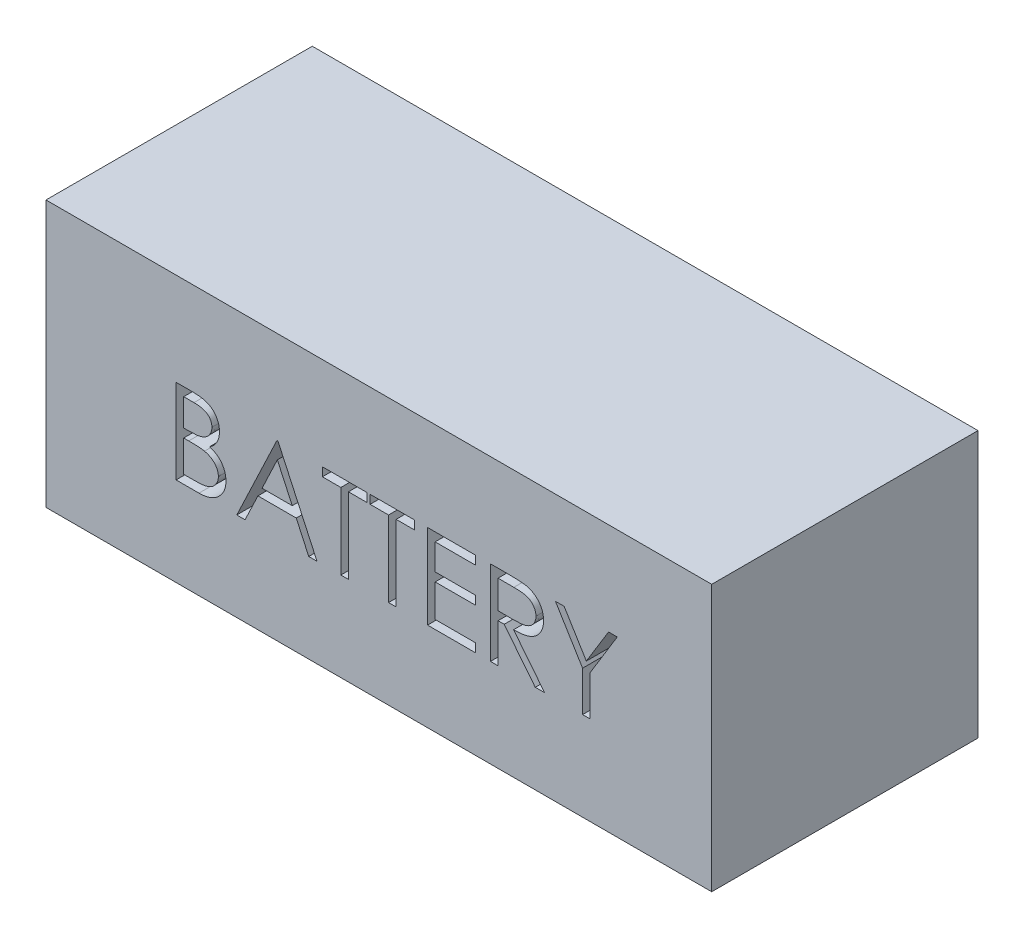
from build123d import *

# Parameters (mm, degrees)
SKETCH1_W           = 60
SKETCH1_H           = 60
BOSS_EXTRUDE1_DEPTH = 75
CUT_EXTRUDE1_DEPTH  = 10


with BuildPart() as part:
    # Sketch1 → Boss-Extrude1 (new, symmetric)
    with BuildSketch(Plane(origin=(0, 0, 0), x_dir=(0, 0, -1), z_dir=(1, 0, 0))):
        Rectangle(SKETCH1_W, SKETCH1_H)
    extrude(amount=BOSS_EXTRUDE1_DEPTH, both=True)

    # Sketch2 → Cut-Extrude1 (cut)
    # profile 1 of 7: a face of its own
    with BuildSketch(Plane.XY.offset(30)):
        with BuildLine():
            Line((-45.686803881, 9.075416007), (-41.969916862, 9.075416007))
            add(Edge.make_bspline(
                [(-41.969916862, 9.075416007), (-41.78797043, 9.074459423), (-41.435312964, 9.072605324), (-40.922490002, 9.043849996), (-40.442164333, 9.00464145), (-39.994196658, 8.942429089), (-39.578793977, 8.867362416), (-39.194704409, 8.776456817), (-38.843149329, 8.66745482), (-38.42343572, 8.494120061), (-37.944896123, 8.236546816), (-37.426744872, 7.855935625), (-36.983673226, 7.390394648), (-36.601659128, 6.865253337), (-36.297941605, 6.287571494), (-36.078217287, 5.671117909), (-35.939109423, 5.023843857), (-35.924803231, 4.579471703), (-35.917573112, 4.354893171)],
                knots=[0, 0, 0, 0, 1.001505555, 1.941167018, 2.826882275, 3.653841531, 4.429895133, 5.150066043, 5.825578002, 6.45369114, 7.647487171, 8.808567382, 9.977351308, 11.170798116, 12.373658725, 13.556498008, 14.765093433, 16, 16, 16, 16], degree=3))
            add(Edge.make_bspline(
                [(-35.917573112, 4.354893171), (-35.923523343, 4.144512832), (-35.93521611, 3.731095626), (-36.047027414, 3.12642626), (-36.222073338, 2.550837483), (-36.465397623, 2.006429929), (-36.781638488, 1.50550412), (-37.15642448, 1.044019143), (-37.608599648, 0.641514104), (-37.947380711, 0.416490592), (-38.119466141, 0.302188844)],
                knots=[0, 0, 0, 0, 1.044552857, 2.05264487, 3.044412934, 4.028983338, 5.005914585, 5.980388656, 6.974128949, 8, 8, 8, 8], degree=3))
            add(Edge.make_bspline(
                [(-38.119466141, 0.302188844), (-37.903055813, 0.219103635), (-37.489009248, 0.06014105), (-36.919218238, -0.220903404), (-36.428300581, -0.526585748), (-36.01248183, -0.860406247), (-35.656858308, -1.22022706), (-35.346327297, -1.611324182), (-35.081361532, -2.038799421), (-34.854324048, -2.498195806), (-34.677165819, -2.984822441), (-34.544491254, -3.494114808), (-34.468468423, -4.024246673), (-34.457649976, -4.385028523), (-34.452188496, -4.567162118)],
                knots=[0, 0, 0, 0, 1.27268992, 2.434971085, 3.483601985, 4.442670788, 5.356604649, 6.2567628, 7.179492994, 8.113709626, 9.066344395, 10.018646069, 10.999752585, 12, 12, 12, 12], degree=3))
            add(Edge.make_bspline(
                [(-34.452188496, -4.567162118), (-34.45750533, -4.753127522), (-34.467966348, -5.119019664), (-34.545145909, -5.656529753), (-34.675824048, -6.170199106), (-34.855825574, -6.663350172), (-35.090751886, -7.135028903), (-35.376654092, -7.585769669), (-35.717548745, -8.011043668), (-36.098890932, -8.415576531), (-36.530303467, -8.779310631), (-36.995753504, -9.10324612), (-37.50110276, -9.369652544), (-38.03805147, -9.593441175), (-38.612622962, -9.76438607), (-39.222237153, -9.883979651), (-39.866368282, -9.964561352), (-40.308381356, -9.971186424), (-40.535061092, -9.974583993)],
                knots=[0, 0, 0, 0, 0.978564426, 1.925352924, 2.850884081, 3.763762016, 4.682927383, 5.618979971, 6.567305752, 7.547517671, 8.540179244, 9.531824382, 10.526200242, 11.540722885, 12.589160233, 13.674978461, 14.80764778, 16, 16, 16, 16], degree=3))
            Line((-40.535061092, -9.974583993), (-45.686803881, -9.974583993))
            Line((-45.686803881, -9.974583993), (-45.686803881, 9.075416007))
        make_face()
        with BuildLine():
            Line((-43.977188496, 7.121569853), (-43.977188496, 1.015800623))
            Line((-43.977188496, 1.015800623), (-42.82854066, 1.015800623))
            add(Edge.make_bspline(
                [(-42.82854066, 1.015800623), (-42.660635074, 1.017977346), (-42.336207264, 1.02218322), (-41.866380398, 1.034231078), (-41.430271371, 1.067966142), (-41.028632965, 1.101691512), (-40.662097663, 1.156526053), (-40.331477502, 1.221797465), (-40.03158371, 1.290828706), (-39.685747041, 1.408228341), (-39.293464279, 1.581733973), (-38.875272669, 1.85100211), (-38.506603628, 2.171718947), (-38.195287506, 2.541784039), (-37.940499359, 2.949269993), (-37.763531852, 3.387675157), (-37.643531634, 3.846073304), (-37.632692013, 4.160769794), (-37.627188496, 4.320548219)],
                knots=[0, 0, 0, 0, 1.156816544, 2.235205308, 3.236616184, 4.169592532, 5.011045266, 5.787822928, 6.49130361, 7.128639758, 8.301311294, 9.436451833, 10.541879658, 11.654887649, 12.756523258, 13.837046038, 14.901820046, 16, 16, 16, 16], degree=3))
            add(Edge.make_bspline(
                [(-37.627188496, 4.320548219), (-37.63005242, 4.426279918), (-37.635670319, 4.633684192), (-37.681680437, 4.936031391), (-37.759881092, 5.220386673), (-37.860325174, 5.490646902), (-38.000689323, 5.738361401), (-38.165953316, 5.97209508), (-38.365628287, 6.183888182), (-38.592907375, 6.381842166), (-38.854211451, 6.557344524), (-39.149384625, 6.711054964), (-39.48242041, 6.834829763), (-39.847706092, 6.943230535), (-40.25086444, 7.01936682), (-40.68724308, 7.082794545), (-41.160416337, 7.115085612), (-41.487777538, 7.11936023), (-41.656996189, 7.121569853)],
                knots=[0, 0, 0, 0, 0.91205012, 1.789085906, 2.630437955, 3.453916878, 4.269457761, 5.079663411, 5.91843418, 6.774407191, 7.675494373, 8.627863946, 9.638891023, 10.736472738, 11.911756761, 13.175263542, 14.539845004, 16, 16, 16, 16], degree=3))
            Line((-41.656996189, 7.121569853), (-43.977188496, 7.121569853))
        make_face(mode=Mode.SUBTRACT)
        with BuildLine():
            Line((-43.977188496, -0.938045531), (-43.977188496, -8.020737839))
            Line((-43.977188496, -8.020737839), (-41.542513016, -8.020737839))
            add(Edge.make_bspline(
                [(-41.542513016, -8.020737839), (-41.368238576, -8.018649157), (-41.032347569, -8.014623497), (-40.547382302, -8.001481421), (-40.097894265, -7.971587749), (-39.685934555, -7.924529625), (-39.307054806, -7.873484066), (-38.965800165, -7.804842665), (-38.659404355, -7.726199037), (-38.304125623, -7.604637328), (-37.904056528, -7.415789394), (-37.472923152, -7.131050533), (-37.089603308, -6.791833672), (-36.764091826, -6.399235411), (-36.497321131, -5.972344903), (-36.303253582, -5.519796641), (-36.183560491, -5.04906827), (-36.169070684, -4.728120877), (-36.161803881, -4.567162118)],
                knots=[0, 0, 0, 0, 1.160039823, 2.235823828, 3.228722157, 4.157150951, 4.99529583, 5.772374946, 6.472645482, 7.099169577, 8.269452708, 9.405989375, 10.527446681, 11.663510218, 12.788923519, 13.866172445, 14.929861265, 16, 16, 16, 16], degree=3))
            add(Edge.make_bspline(
                [(-36.161803881, -4.567162118), (-36.163306677, -4.466505507), (-36.16628803, -4.266815886), (-36.211249377, -3.973359785), (-36.276639154, -3.689101817), (-36.36117453, -3.413270115), (-36.484289058, -3.150851596), (-36.62801611, -2.896656236), (-36.796534596, -2.650348012), (-37.059120699, -2.33894989), (-37.441056786, -1.980173005), (-37.983746521, -1.6289046), (-38.600815743, -1.345615821), (-39.04836824, -1.225331529), (-39.279562294, -1.163195772)],
                knots=[0, 0, 0, 0, 0.723448775, 1.435228256, 2.130040452, 2.821711965, 3.505591119, 4.210454504, 4.921174351, 5.648778258, 7.137944449, 8.670945889, 10.280296675, 12, 12, 12, 12], degree=3))
            add(Edge.make_bspline(
                [(-39.279562294, -1.163195772), (-39.37224923, -1.144390243), (-39.573213626, -1.103615979), (-39.900914885, -1.060575479), (-40.2750344, -1.022230224), (-40.69643606, -0.993866638), (-41.165653024, -0.96454845), (-41.683687396, -0.953146638), (-42.248423637, -0.939543523), (-42.640267835, -0.938557635), (-42.843805083, -0.938045531)],
                knots=[0, 0, 0, 0, 0.634451884, 1.375622551, 2.216452059, 3.157844607, 4.20941857, 5.370758133, 6.634282058, 8, 8, 8, 8], degree=3))
            Line((-42.843805083, -0.938045531), (-43.977188496, -0.938045531))
        make_face(mode=Mode.SUBTRACT)
    # profile 2 of 7: a face of its own
    with BuildSketch(Plane.XY.offset(30)):
        Polygon((-22.729111573, 9.075416007), (-13.936803881, -9.974583993), (-15.795247391, -9.974583993), (-18.611533448, -3.868814762), (-27.247380804, -3.868814762), (-30.139988977, -9.974583993), (-32.009880804, -9.974583993), (-22.973342342, 9.075416007), align=None)
        Polygon((-22.870307487, 5.358528988), (-26.316250996, -1.914968608), (-19.51213441, -1.914968608), align=None, mode=Mode.SUBTRACT)
    # profile 3 of 7: a face of its own
    with BuildSketch(Plane.XY.offset(30)):
        Polygon((-12.715650035, 7.121569853), (-12.715650035, 9.075416007), (-2.702188496, 9.075416007), (-2.702188496, 7.121569853), (-6.854111573, 7.121569853), (-6.854111573, -9.974583993), (-8.563726958, -9.974583993), (-8.563726958, 7.121569853), align=None)
    # profile 4 of 7: a face of its own
    with BuildSketch(Plane.XY.offset(30)):
        Polygon((-1.969496189, 7.121569853), (-1.969496189, 9.075416007), (8.04396535, 9.075416007), (8.04396535, 7.121569853), (3.892042273, 7.121569853), (3.892042273, -9.974583993), (2.182426888, -9.974583993), (2.182426888, 7.121569853), align=None)
    # profile 5 of 7: a face of its own
    with BuildSketch(Plane.XY.offset(30)):
        Polygon((10.974734581, 9.075416007), (21.720888427, 9.075416007), (21.720888427, 7.121569853), (12.684349965, 7.121569853), (12.684349965, 1.260031392), (21.720888427, 1.260031392), (21.720888427, -0.693814762), (12.684349965, -0.693814762), (12.684349965, -8.020737839), (21.720888427, -8.020737839), (21.720888427, -9.974583993), (10.974734581, -9.974583993), align=None)
    # profile 6 of 7: a face of its own
    with BuildSketch(Plane.XY.offset(30)):
        with BuildLine():
            Line((25.140119196, 9.075416007), (28.952408859, 9.075416007))
            add(Edge.make_bspline(
                [(28.952408859, 9.075416007), (29.206814145, 9.074569175), (29.695300474, 9.072943163), (30.395106416, 9.063876654), (31.030979616, 9.037890518), (31.602587598, 9.015528085), (32.109919878, 8.974750518), (32.554532132, 8.935776139), (32.934376599, 8.884756642), (33.164314733, 8.837374269), (33.268424484, 8.815920815)],
                knots=[0, 0, 0, 0, 1.410062039, 2.707475311, 3.878576406, 4.937260626, 5.877586885, 6.699081471, 7.410979367, 8, 8, 8, 8], degree=3))
            add(Edge.make_bspline(
                [(33.268424484, 8.815920815), (33.407797682, 8.781485135), (33.683570867, 8.713348381), (34.080627655, 8.569332554), (34.45898419, 8.402674311), (34.817068805, 8.206928919), (35.153087897, 7.980643333), (35.470506132, 7.727723981), (35.770763868, 7.449554761), (36.041718169, 7.139122266), (36.297200722, 6.813440692), (36.512675961, 6.461267387), (36.698421515, 6.092995359), (36.846306757, 5.704879271), (36.965385441, 5.300683055), (37.049348258, 4.876745462), (37.099701151, 4.434997869), (37.104827536, 4.133692679), (37.107426888, 3.980914805)],
                knots=[0, 0, 0, 0, 1.027469482, 2.033020251, 3.019912614, 3.986113645, 4.951240523, 5.91722682, 6.890402269, 7.87763091, 8.8651537, 9.85103654, 10.82876324, 11.815024772, 12.821070561, 13.842952187, 14.906261191, 16, 16, 16, 16], degree=3))
            add(Edge.make_bspline(
                [(37.107426888, 3.980914805), (37.099431341, 3.727086593), (37.083829959, 3.231802008), (36.938369037, 2.513013496), (36.700099694, 1.842511655), (36.37176865, 1.221140726), (35.953651218, 0.661012785), (35.451140569, 0.169030449), (34.863956369, -0.242666789), (34.31733395, -0.528159912), (33.834475234, -0.711001314), (33.436965346, -0.839650639), (33.003349368, -0.939047907), (32.537781876, -1.028093767), (32.038325408, -1.095322276), (31.506177051, -1.144561597), (30.940957283, -1.175335776), (30.552668919, -1.179918689), (30.352919677, -1.1822763)],
                knots=[0, 0, 0, 0, 1.260483769, 2.459530307, 3.627416485, 4.787058657, 5.939039949, 7.08810263, 8.267026773, 9.491475466, 10.141966685, 10.831826277, 11.566392101, 12.351337768, 13.187381173, 14.07005841, 15.007169909, 16, 16, 16, 16], degree=3))
            Line((30.352919677, -1.1822763), (37.351657658, -9.974583993))
            Line((37.351657658, -9.974583993), (35.237535061, -9.974583993))
            Line((35.237535061, -9.974583993), (28.238797081, -1.1822763))
            Line((28.238797081, -1.1822763), (26.849734581, -1.1822763))
            Line((26.849734581, -1.1822763), (26.849734581, -9.974583993))
            Line((26.849734581, -9.974583993), (25.140119196, -9.974583993))
            Line((25.140119196, -9.974583993), (25.140119196, 9.075416007))
        make_face()
        with BuildLine():
            Line((26.849734581, 7.121569853), (26.849734581, 0.771569853))
            Line((26.849734581, 0.771569853), (30.337655254, 0.744857113))
            add(Edge.make_bspline(
                [(30.337655254, 0.744857113), (30.500505751, 0.744785068), (30.816156398, 0.744645424), (31.272815731, 0.766382977), (31.698012339, 0.791111609), (32.090119861, 0.828935904), (32.449313464, 0.877682523), (32.775413613, 0.938658766), (33.068952624, 1.009699279), (33.411300383, 1.119653842), (33.79358779, 1.293858027), (34.209049021, 1.547307384), (34.562847459, 1.866090733), (34.861757539, 2.230617686), (35.10194773, 2.631409269), (35.271286197, 3.063661222), (35.37874149, 3.516461205), (35.39141543, 3.827673478), (35.397811504, 3.984730911)],
                knots=[0, 0, 0, 0, 1.146690395, 2.22261258, 3.21895312, 4.145990853, 4.996080663, 5.770904154, 6.481378293, 7.121626537, 8.300444488, 9.431385265, 10.535395872, 11.636531494, 12.74115979, 13.810798291, 14.895190096, 16, 16, 16, 16], degree=3))
            add(Edge.make_bspline(
                [(35.397811504, 3.984730911), (35.39126853, 4.137928691), (35.378302745, 4.44151079), (35.272445876, 4.885952245), (35.093433672, 5.305416645), (34.852194062, 5.698197627), (34.558284376, 6.05473599), (34.213654567, 6.359792637), (33.827727719, 6.611521866), (33.467023054, 6.772382137), (33.144619697, 6.87100591), (32.864695405, 6.940408673), (32.548402933, 6.996167854), (32.194206508, 7.040843157), (31.803618204, 7.07924221), (31.374663089, 7.105105463), (30.910187185, 7.120420923), (30.588258888, 7.121177964), (30.421609581, 7.121569853)],
                knots=[0, 0, 0, 0, 1.101028733, 2.181837193, 3.264309656, 4.369019818, 5.486613113, 6.575447106, 7.666700264, 8.788928104, 9.402425223, 10.0903467, 10.862060571, 11.710948788, 12.657782767, 13.684531032, 14.801375019, 16, 16, 16, 16], degree=3))
            Line((30.421609581, 7.121569853), (26.849734581, 7.121569853))
        make_face(mode=Mode.SUBTRACT)
    # profile 7 of 7: a face of its own
    with BuildSketch(Plane.XY.offset(30)):
        Polygon((39.79396535, 9.075416007), (41.751627609, 9.075416007), (46.750726167, 0.897501344), (51.753640831, 9.075416007), (53.715119196, 9.075416007), (47.609349965, -0.918965002), (47.609349965, -9.974583993), (45.899734581, -9.974583993), (45.899734581, -0.918965002), align=None)
    extrude(amount=-CUT_EXTRUDE1_DEPTH, mode=Mode.SUBTRACT)


solid = part.part
